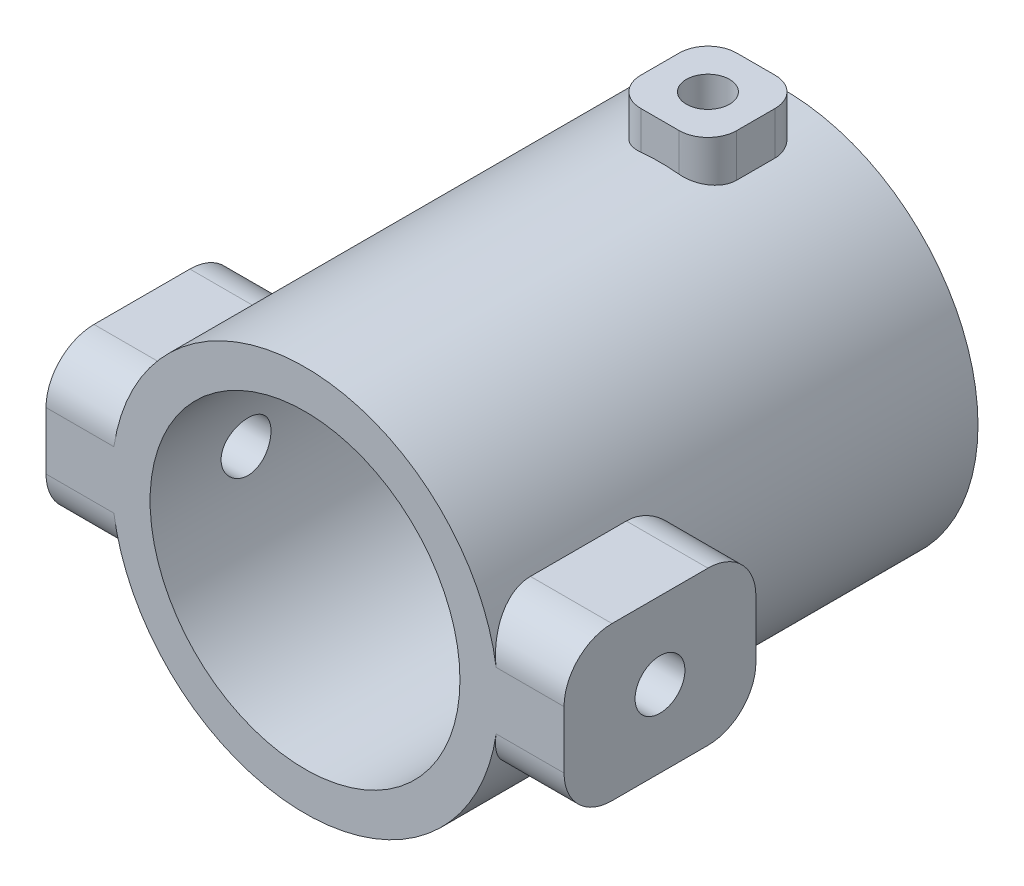
from build123d import *

# Parameters (mm, degrees)
ESQUISSE1_R                  = 20.15
ESQUISSE1_R_2                = 16.15
BOSS_EXTRU_1_DEPTH           = 50
ESQUISSE2_W                  = 10
ESQUISSE2_H                  = 16
BOSS_EXTRU_2_DEPTH           = 20
ENL_V_MAT_EXTRU_1_DEPTH      = 77.302178868
ENL_V_MAT_EXTRU_1_DEPTH_BACK = 77.302178868
ESQUISSE3_R                  = 2.6
CONG_1_R                     = 5
BOSS_EXTRU_3_DEPTH           = 5
BOSS_EXTRU_3_DEPTH_BACK      = 5
ESQUISSE5_W                  = 10
ESQUISSE5_H                  = 6
ESQUISSE4_R                  = 2.25
ENL_V_MAT_EXTRU_2_DEPTH      = 62.684682178
CONG_2_R                     = 3


with BuildPart() as part:
    # Esquisse1 → Boss.-Extru.1 (new body)
    with BuildSketch(Plane.XY):
        Circle(ESQUISSE1_R)
        Circle(ESQUISSE1_R_2, mode=Mode.SUBTRACT)
    extrude(amount=BOSS_EXTRU_1_DEPTH)

    # Esquisse2 → Boss.-Extru.2 (add)
    with BuildSketch(Plane.XY.offset(50)):
        with Locations((-22, 0)):
            Rectangle(ESQUISSE2_W, ESQUISSE2_H)
        with Locations((22, 0)):
            Rectangle(ESQUISSE2_W, ESQUISSE2_H)
    extrude(amount=-BOSS_EXTRU_2_DEPTH)

    # Esquisse3 → Enlèv. mat.-Extru.1 (cut, two sides: drawn at the far end of the back side and taken through both)
    with BuildSketch(Plane.ZY.offset(27).offset(-ENL_V_MAT_EXTRU_1_DEPTH_BACK)):
        with Locations(Location((40, 0, 0), (0, 0, 270))):
            Circle(ESQUISSE3_R)
    extrude(amount=ENL_V_MAT_EXTRU_1_DEPTH + ENL_V_MAT_EXTRU_1_DEPTH_BACK, mode=Mode.SUBTRACT)

    # Congé1
    cong_1_edges = [part.edges().sort_by_distance(p)[0] for p in [
        (22.746925165, 8, 30),
        (22.746925165, -8, 30),
        (22.746925165, 8, 50),
        (22.746925165, -8, 50),
        (-22.746925165, 8, 30),
        (-22.746925165, -8, 30),
        (-22.746925165, 8, 50),
        (-22.746925165, -8, 50),
    ]]
    fillet(cong_1_edges, radius=CONG_1_R)

    # Esquisse5 → Boss.-Extru.3 (add, two sides: drawn at the far end of the back side and taken through both)
    with BuildSketch(Plane(origin=(0, 0, 0), x_dir=(0, 0, -1), z_dir=(1, 0, 0)).offset(-BOSS_EXTRU_3_DEPTH_BACK)):
        with Locations((-8, 21)):
            Rectangle(ESQUISSE5_W, ESQUISSE5_H)
    extrude(amount=BOSS_EXTRU_3_DEPTH + BOSS_EXTRU_3_DEPTH_BACK)

    # Esquisse4 → Enlèv. mat.-Extru.2 (cut, through all)
    with BuildSketch(Plane(origin=(0, 0, 0), x_dir=(1, 0, 0), z_dir=(0, 1, 0))):
        with Locations(Location((0, -8, 0), (0, 0, 90))):
            Circle(ESQUISSE4_R)
    extrude(amount=ENL_V_MAT_EXTRU_2_DEPTH, mode=Mode.SUBTRACT)

    # Congé2
    cong_2_edges = [part.edges().sort_by_distance(p)[0] for p in [
        (5, 21.759898821, 3),
        (5, 21.759898821, 13),
        (-5, 21.759898821, 13),
        (-5, 21.759898821, 3),
    ]]
    fillet(cong_2_edges, radius=CONG_2_R)


solid = part.part
